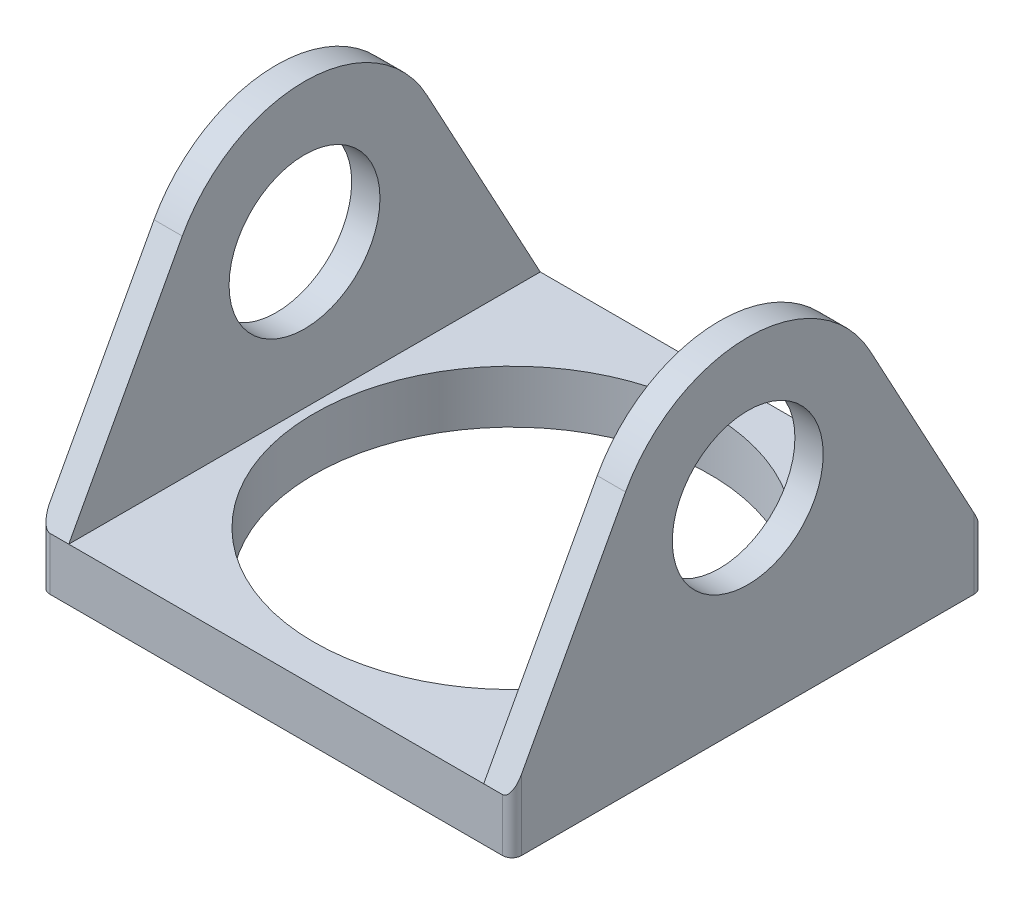
from build123d import *

# Parameters (mm, degrees)
SKETCH1_W               = 250
SKETCH1_H               = 250
BOSS_EXTRUDE1_DEPTH     = 28
CUT_EXTRUDE1_REACH      = 180.98
SKETCH2_R               = 105
SKETCH3_W               = 15
SKETCH3_H               = 250
BOSS_EXTRUDE2_DEPTH     = 150
SKETCH4_R               = 40
CUT_EXTRUDE2_DEPTH      = 332.374410599
CUT_EXTRUDE4_DEPTH      = 332.374410599
CUT_EXTRUDE4_DEPTH_BACK = 332.374410599
FILLET1_R               = 5


with BuildPart() as part:
    # Sketch1 → Boss-Extrude1 (new body)
    with BuildSketch(Plane(origin=(0, 0, 0), x_dir=(1, 0, 0), z_dir=(0, 1, 0))):
        Rectangle(SKETCH1_W, SKETCH1_H)
    extrude(amount=BOSS_EXTRUDE1_DEPTH)

    # Sketch2 → Cut-Extrude1 (cut, up to next)
    with BuildSketch(Plane(origin=(0, 28, 0), x_dir=(1, 0, 0), z_dir=(0, 1, 0)), mode=Mode.PRIVATE) as cut_extrude1_sk1:
        with Locations(Location((0, 0, 0), (0, 0, 270))):
            Circle(SKETCH2_R)
    cut_extrude1_tool1 = extrude(cut_extrude1_sk1.sketch, amount=-CUT_EXTRUDE1_REACH, mode=Mode.PRIVATE) & part.part
    add(cut_extrude1_tool1.solids().sort_by_distance((0, 28, 0))[0], mode=Mode.SUBTRACT)

    # Sketch3 → Boss-Extrude2 (add)
    with BuildSketch(Plane(origin=(0, 28, 0), x_dir=(1, 0, 0), z_dir=(0, 1, 0))):
        with Locations((-117.5, 0)):
            Rectangle(SKETCH3_W, SKETCH3_H)
    boss_extrude2 = extrude(amount=BOSS_EXTRUDE2_DEPTH)

    # Mirror1: Boss-Extrude2 across plane
    add(boss_extrude2.mirror(Plane(origin=(0, 0, 0), x_dir=(0, 0, 1), z_dir=(1, 0, 0))))

    # Sketch4 → Cut-Extrude2 (cut, through all)
    with BuildSketch(Plane(origin=(125, 0, 0), x_dir=(0, 0, -1), z_dir=(1, 0, 0))):
        with Locations((0, 104.34)):
            Circle(SKETCH4_R)
    extrude(amount=-CUT_EXTRUDE2_DEPTH, mode=Mode.SUBTRACT)

    # Sketch5 → Cut-Extrude4 (cut, two sides: drawn at the far end of the back side and taken through both)
    with BuildSketch(Plane(origin=(125, 0, 0), x_dir=(0, 0, -1), z_dir=(1, 0, 0)).offset(-CUT_EXTRUDE4_DEPTH_BACK)):
        with BuildLine():
            Line((407.036525122, -493.744479882), (125, 28))
            Line((125, 28), (64.798533304, 139.367784424))
            ThreePointArc((64.798533304, 139.367784424), (0, 178), (-64.798533304, 139.367784424))
            Line((-64.798533304, 139.367784424), (-125, 28))
            Line((-125, 28), (-407.036525122, -493.744479882))
            Line((-407.036525122, -493.744479882), (-407.036525122, 692.445899087))
            Line((-407.036525122, 692.445899087), (407.036525122, 692.445899087))
            Line((407.036525122, 692.445899087), (407.036525122, -493.744479882))
        make_face()
    extrude(amount=CUT_EXTRUDE4_DEPTH + CUT_EXTRUDE4_DEPTH_BACK, mode=Mode.SUBTRACT)

    # Fillet1
    fillet1_edges = [part.edges().sort_by_distance(p)[0] for p in [
        (125, 14, 125),
        (-125, 14, 125),
        (-125, 14, -125),
        (125, 14, -125),
    ]]
    fillet(fillet1_edges, radius=FILLET1_R)


solid = part.part
